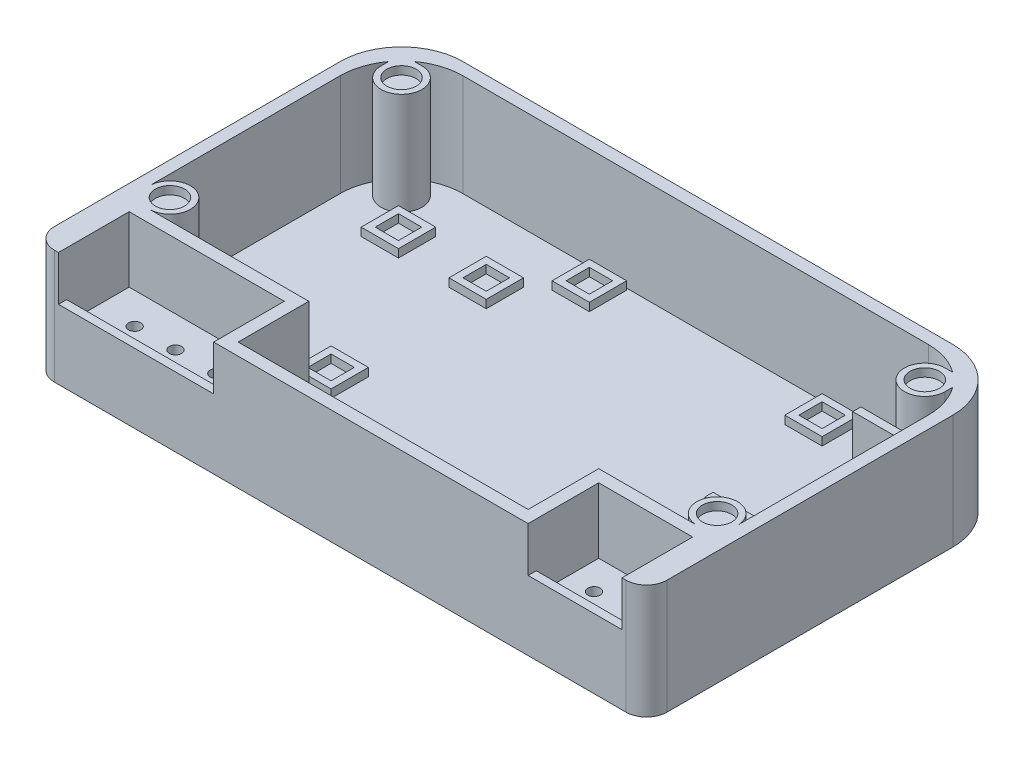
from build123d import *

# Parameters (mm, degrees)
CROQUIS1_W              = 150
CROQUIS1_H              = 90
SALIENTE_EXTRUIR1_DEPTH = 3
SALIENTE_EXTRUIR2_DEPTH = 25
CROQUIS3_W              = 38
CROQUIS3_H              = 2
CROQUIS3_W_2            = 23
SALIENTE_EXTRUIR3_DEPTH = 14
SALIENTE_EXTRUIR4_START = 6
CROQUIS4_W              = 38
CROQUIS4_H              = 15.3
CROQUIS4_R              = 1.5
CROQUIS4_W_2            = 23
SALIENTE_EXTRUIR4_DEPTH = 3
CORTAR_EXTRUIR1_REACH   = 110.14
CROQUIS5_W              = 20
CROQUIS5_H              = 6
CROQUIS5_W_2            = 10
REDONDEO1_R             = 15
REDONDEO2_R             = 5
SALIENTE_EXTRUIR5_START = 25
SALIENTE_EXTRUIR5_DEPTH = 25
CROQUIS7_R              = 3.6
CORTAR_EXTRUIR2_DEPTH   = 2
CROQUIS8_W              = 9.129710912
CROQUIS8_H              = 9.129710912
CROQUIS8_W_2            = 5.7
CROQUIS8_H_2            = 5.7
SALIENTE_EXTRUIR6_DEPTH = 2
CROQUIS9_W              = 15
CROQUIS9_H              = 2
SALIENTE_EXTRUIR7_DEPTH = 20


with BuildPart() as part:
    # Croquis1 → Saliente-Extruir1 (new body)
    with BuildSketch(Plane(origin=(0, 0, 0), x_dir=(1, 0, 0), z_dir=(0, 1, 0))):
        Rectangle(CROQUIS1_W, CROQUIS1_H)
    extrude(amount=SALIENTE_EXTRUIR1_DEPTH)

    # Croquis2 → Saliente-Extruir2 (add)
    with BuildSketch(Plane(origin=(0, 3, 0), x_dir=(1, 0, 0), z_dir=(0, 1, 0))):
        Polygon((-75, -45), (-75, 45), (75, 45), (75, -45), (69, -45), (69, -27.7), (46, -27.7), (46, -45), (-31, -45), (-31, -27.7), (-69, -27.7), (-69, -45), align=None)
        Polygon((-72, 42), (72, 42), (72, -24.7), (43, -24.7), (43, -42), (-28, -42), (-28, -24.7), (-72, -24.7), align=None, mode=Mode.SUBTRACT)
    extrude(amount=SALIENTE_EXTRUIR2_DEPTH)

    # Croquis3 → Saliente-Extruir3 (add)
    with BuildSketch(Plane(origin=(0, 3, 0), x_dir=(1, 0, 0), z_dir=(0, 1, 0))):
        with Locations((-50, -44)):
            Rectangle(CROQUIS3_W, CROQUIS3_H)
        with Locations((57.5, -44)):
            Rectangle(CROQUIS3_W_2, CROQUIS3_H)
    extrude(amount=SALIENTE_EXTRUIR3_DEPTH)

    # Croquis4 → Saliente-Extruir4 (add)
    # profile 1 of 2: a face of its own
    with BuildSketch(Plane(origin=(0, 3, 0), x_dir=(1, 0, 0), z_dir=(0, 1, 0)).offset(SALIENTE_EXTRUIR4_START)):
        with Locations((-50, -35.35)):
            Rectangle(CROQUIS4_W, CROQUIS4_H)
        with Locations(Location((-50, -35.35, 0), (0, 0, 270))):
            Circle(CROQUIS4_R, mode=Mode.SUBTRACT)
        with Locations(Location((-40, -35.35, 0), (0, 0, 270))):
            Circle(CROQUIS4_R, mode=Mode.SUBTRACT)
        with Locations(Location((-60, -35.35, 0), (0, 0, 270))):
            Circle(CROQUIS4_R, mode=Mode.SUBTRACT)
    # profile 2 of 2: a face of its own
    with BuildSketch(Plane(origin=(0, 3, 0), x_dir=(1, 0, 0), z_dir=(0, 1, 0)).offset(SALIENTE_EXTRUIR4_START)):
        with Locations((57.5, -35.35)):
            Rectangle(CROQUIS4_W_2, CROQUIS4_H)
        with Locations(Location((62.5, -35.35, 0), (0, 0, 270))):
            Circle(CROQUIS4_R, mode=Mode.SUBTRACT)
        with Locations(Location((52.5, -35.35, 0), (0, 0, 270))):
            Circle(CROQUIS4_R, mode=Mode.SUBTRACT)
    extrude(amount=SALIENTE_EXTRUIR4_DEPTH)

    # Croquis5 → Cortar-Extruir1 (cut, up to next)
    with BuildSketch(Plane.XY.offset(27.7), mode=Mode.PRIVATE) as cortar_extruir1_sk1:
        with Locations((-50, 6)):
            Rectangle(CROQUIS5_W, CROQUIS5_H)
    cortar_extruir1_tool1 = extrude(cortar_extruir1_sk1.sketch, amount=-CORTAR_EXTRUIR1_REACH, mode=Mode.PRIVATE) & part.part
    # Croquis5 → Cortar-Extruir1 (cut, up to next)
    with BuildSketch(Plane.XY.offset(27.7), mode=Mode.PRIVATE) as cortar_extruir1_sk2:
        with Locations((57.5, 6)):
            Rectangle(CROQUIS5_W_2, CROQUIS5_H)
    cortar_extruir1_tool2 = extrude(cortar_extruir1_sk2.sketch, amount=-CORTAR_EXTRUIR1_REACH, mode=Mode.PRIVATE) & part.part
    add(cortar_extruir1_tool1.solids().sort_by_distance((-50, 6, 27.7))[0], mode=Mode.SUBTRACT)
    add(cortar_extruir1_tool2.solids().sort_by_distance((57.5, 6, 27.7))[0], mode=Mode.SUBTRACT)

    # Redondeo1
    redondeo1_edges = [part.edges().sort_by_distance(p)[0] for p in [
        (72, 15.5, -42),
        (-72, 15.5, -42),
        (-75, 14, -45),
        (75, 14, -45),
    ]]
    fillet(redondeo1_edges, radius=REDONDEO1_R)

    # Redondeo2
    redondeo2_edges = [part.edges().sort_by_distance(p)[0] for p in [
        (75, 14, 45),
        (-75, 14, 45),
    ]]
    fillet(redondeo2_edges, radius=REDONDEO2_R)

    # Croquis6 → Saliente-Extruir5 (add)
    with BuildSketch(Plane(origin=(0, 3, 0), x_dir=(1, 0, 0), z_dir=(0, 1, 0)).offset(SALIENTE_EXTRUIR5_START)):
        with BuildLine():
            Line((-64.071067812, 39.071067812), (-65.90445517, 39.071067812))
            ThreePointArc((-65.90445517, 39.071067812), (-67.606601718, 37.606601718), (-69.071067812, 35.90445517))
            Line((-69.071067812, 35.90445517), (-69.071067812, 34.071067812))
            ThreePointArc((-69.071067812, 34.071067812), (-60.535533906, 30.535533906), (-64.071067812, 39.071067812))
        make_face()
        with BuildLine():
            Line((-67, -24.7), (-72, -24.7))
            Line((-72, -24.7), (-72, -19.7))
            ThreePointArc((-72, -19.7), (-63.464466094, -16.164466094), (-67, -24.7))
        make_face()
        with BuildLine():
            Line((72, -24.7), (72, -19.7))
            ThreePointArc((72, -19.7), (63.464466094, -16.164466094), (67, -24.7))
            Line((67, -24.7), (72, -24.7))
        make_face()
        with BuildLine():
            Line((69.071067812, 34.071067812), (69.071067812, 35.90445517))
            ThreePointArc((69.071067812, 35.90445517), (67.606601718, 37.606601718), (65.90445517, 39.071067812))
            Line((65.90445517, 39.071067812), (64.071067812, 39.071067812))
            ThreePointArc((64.071067812, 39.071067812), (60.535533906, 30.535533906), (69.071067812, 34.071067812))
        make_face()
    extrude(amount=-SALIENTE_EXTRUIR5_DEPTH)

    # Croquis7 → Cortar-Extruir2 (cut)
    with BuildSketch(Plane(origin=(0, 28, 0), x_dir=(1, 0, 0), z_dir=(0, 1, 0))):
        with Locations(Location((-64.071067812, 34.071067812, 0), (0, 0, 270))):
            Circle(CROQUIS7_R)
        with Locations(Location((64.071067812, 34.071067812, 0), (0, 0, 270))):
            Circle(CROQUIS7_R)
        with Locations(Location((67, -19.7, 0), (0, 0, 270))):
            Circle(CROQUIS7_R)
        with Locations(Location((-67, -19.7, 0), (0, 0, 270))):
            Circle(CROQUIS7_R)
    extrude(amount=-CORTAR_EXTRUIR2_DEPTH, mode=Mode.SUBTRACT)

    # Croquis8 → Saliente-Extruir6 (add)
    # profile 1 of 8: a face of its own
    with BuildSketch(Plane(origin=(0, 3, 0), x_dir=(1, 0, 0), z_dir=(0, 1, 0))):
        with Locations((-34.25, 25)):
            Rectangle(CROQUIS8_W, CROQUIS8_H)
        with Locations((-34.25, 25)):
            Rectangle(CROQUIS8_W_2, CROQUIS8_H_2, mode=Mode.SUBTRACT)
    # profile 2 of 8: a face of its own
    with BuildSketch(Plane(origin=(0, 3, 0), x_dir=(1, 0, 0), z_dir=(0, 1, 0))):
        with Locations((-55.75, 25)):
            Rectangle(CROQUIS8_W, CROQUIS8_H)
        with Locations((-55.75, 25)):
            Rectangle(CROQUIS8_W_2, CROQUIS8_H_2, mode=Mode.SUBTRACT)
    # profile 3 of 8: a face of its own
    with BuildSketch(Plane(origin=(0, 3, 0), x_dir=(1, 0, 0), z_dir=(0, 1, 0))):
        with Locations((-34.25, -13)):
            Rectangle(CROQUIS8_W, CROQUIS8_H)
        with Locations((-34.25, -13)):
            Rectangle(CROQUIS8_W_2, CROQUIS8_H_2, mode=Mode.SUBTRACT)
    # profile 4 of 8: a face of its own
    with BuildSketch(Plane(origin=(0, 3, 0), x_dir=(1, 0, 0), z_dir=(0, 1, 0))):
        with Locations((-55.75, -13)):
            Rectangle(CROQUIS8_W, CROQUIS8_H)
        with Locations((-55.75, -13)):
            Rectangle(CROQUIS8_W_2, CROQUIS8_H_2, mode=Mode.SUBTRACT)
    # profile 5 of 8: a face of its own
    with BuildSketch(Plane(origin=(0, 3, 0), x_dir=(1, 0, 0), z_dir=(0, 1, 0))):
        with Locations((36, 37)):
            Rectangle(CROQUIS8_W, CROQUIS8_H)
        with Locations((36, 37)):
            Rectangle(CROQUIS8_W_2, CROQUIS8_H_2, mode=Mode.SUBTRACT)
    # profile 6 of 8: a face of its own
    with BuildSketch(Plane(origin=(0, 3, 0), x_dir=(1, 0, 0), z_dir=(0, 1, 0))):
        with Locations((-21, 37)):
            Rectangle(CROQUIS8_W, CROQUIS8_H)
        with Locations((-21, 37)):
            Rectangle(CROQUIS8_W_2, CROQUIS8_H_2, mode=Mode.SUBTRACT)
    # profile 7 of 8: a face of its own
    with BuildSketch(Plane(origin=(0, 3, 0), x_dir=(1, 0, 0), z_dir=(0, 1, 0))):
        with Locations((-21, -34)):
            Rectangle(CROQUIS8_W, CROQUIS8_H)
        with Locations((-21, -34)):
            Rectangle(CROQUIS8_W_2, CROQUIS8_H_2, mode=Mode.SUBTRACT)
    # profile 8 of 8: a face of its own
    with BuildSketch(Plane(origin=(0, 3, 0), x_dir=(1, 0, 0), z_dir=(0, 1, 0))):
        with Locations((36, -34)):
            Rectangle(CROQUIS8_W, CROQUIS8_H)
        with Locations((36, -34)):
            Rectangle(CROQUIS8_W_2, CROQUIS8_H_2, mode=Mode.SUBTRACT)
    extrude(amount=SALIENTE_EXTRUIR6_DEPTH)

    # Croquis9 → Saliente-Extruir7 (add)
    with BuildSketch(Plane(origin=(0, 3, 0), x_dir=(1, 0, 0), z_dir=(0, 1, 0))):
        with Locations((64.5, -11.7)):
            Rectangle(CROQUIS9_W, CROQUIS9_H)
        with Locations((64.5, 24.5)):
            Rectangle(CROQUIS9_W, CROQUIS9_H)
    extrude(amount=SALIENTE_EXTRUIR7_DEPTH)


solid = part.part
